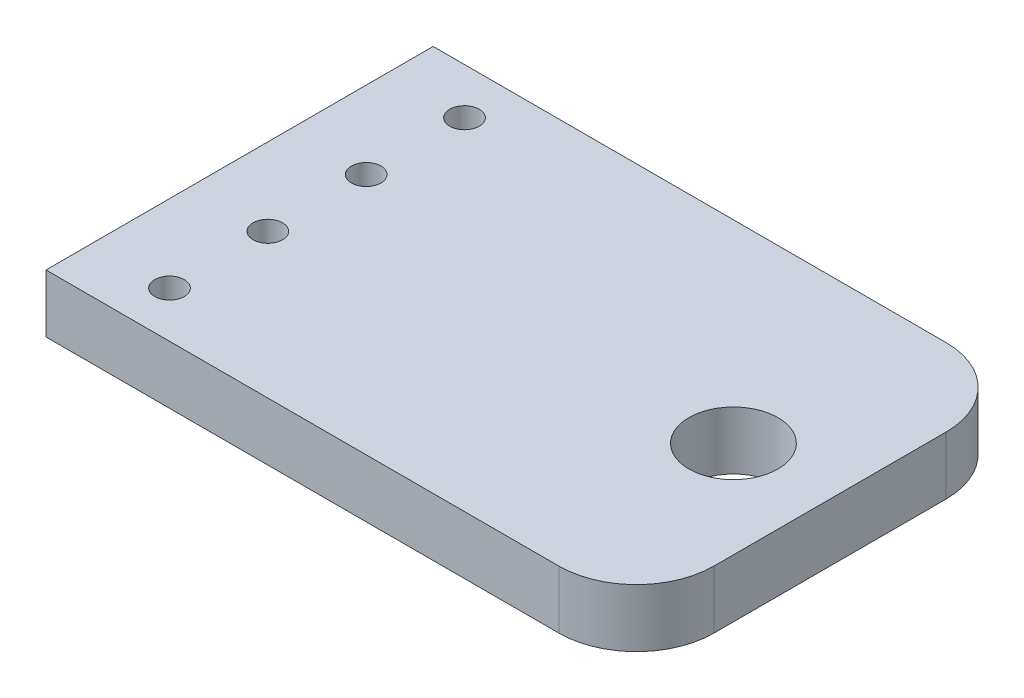
from build123d import *

# Parameters (mm, degrees)
SKETCH1_W           = 15.25
SKETCH1_H           = 10
SKETCH1_R           = 1.15
SKETCH1_R_2         = 0.381
BOSS_EXTRUDE1_DEPTH = 1.5
FILLET2_R           = 2


with BuildPart() as part:
    # Sketch1 → Boss-Extrude1 (new body)
    with BuildSketch(Plane(origin=(0, 0, 0), x_dir=(1, 0, 0), z_dir=(0, 1, 0))):
        with Locations((7.625, 5)):
            Rectangle(SKETCH1_W, SKETCH1_H)
        with Locations(Location((12.755741127, 5, 0), (0, 0, 270))):
            Circle(SKETCH1_R, mode=Mode.SUBTRACT)
        with Locations(Location((2, 6.27, 0), (0, 0, 270))):
            Circle(SKETCH1_R_2, mode=Mode.SUBTRACT)
        with Locations(Location((2, 3.73, 0), (0, 0, 270))):
            Circle(SKETCH1_R_2, mode=Mode.SUBTRACT)
        with Locations(Location((2, 1.19, 0), (0, 0, 270))):
            Circle(SKETCH1_R_2, mode=Mode.SUBTRACT)
        with Locations(Location((2, 8.81, 0), (0, 0, 270))):
            Circle(SKETCH1_R_2, mode=Mode.SUBTRACT)
    extrude(amount=BOSS_EXTRUDE1_DEPTH)

    # Fillet2
    fillet2_edges = [part.edges().sort_by_distance(p)[0] for p in [
        (15.25, 0.75, -10),
        (15.25, 0.75, 0),
    ]]
    fillet(fillet2_edges, radius=FILLET2_R)


solid = part.part
